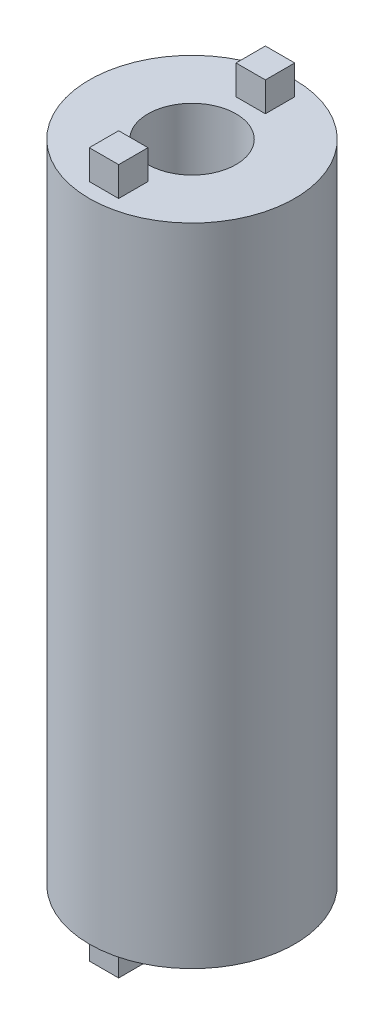
from build123d import *

# Parameters (mm, degrees)
SKETCH2_R           = 3.5
SKETCH2_R_2         = 1.5
BOSS_EXTRUDE1_DEPTH = 22
SKETCH3_W           = 1
SKETCH3_H           = 1
BOSS_EXTRUDE2_DEPTH = 1


with BuildPart() as part:
    # Sketch2 → Boss-Extrude1 (new body)
    with BuildSketch(Plane(origin=(0, 0, 0), x_dir=(1, 0, 0), z_dir=(0, 1, 0))):
        with Locations(Location((0, 0, 0), (0, 0, 270))):
            Circle(SKETCH2_R)
        with Locations(Location((0, 0, 0), (0, 0, 270))):
            Circle(SKETCH2_R_2, mode=Mode.SUBTRACT)
    extrude(amount=BOSS_EXTRUDE1_DEPTH)

    # Sketch3 → Boss-Extrude2 (add)
    with BuildSketch(Plane(origin=(0, 22, 0), x_dir=(1, 0, 0), z_dir=(0, 1, 0))):
        with Locations((0, 2.5)):
            Rectangle(SKETCH3_W, SKETCH3_H)
        with Locations((0, -2.5)):
            Rectangle(SKETCH3_W, SKETCH3_H)
    boss_extrude2 = extrude(amount=BOSS_EXTRUDE2_DEPTH)

    # Mirror1: Boss-Extrude2 across plane
    add(boss_extrude2.mirror(Plane.ZX.offset(11)))


solid = part.part
